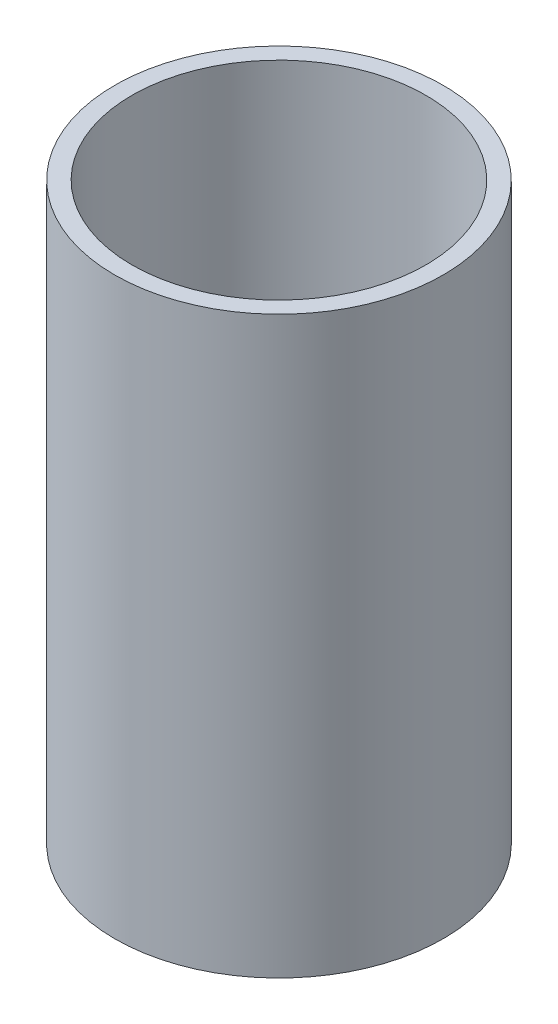
from build123d import *

# Parameters (mm, degrees)
SKETCH13_R                                   = 57.15
SKETCH13_R_2                                 = 51.1302
RURA_GRUBO_CIENNA_STANDARDOWA_S40_PIPE_DEPTH = 200


with BuildPart() as part:
    # Sketch13 → Rura grubościenna; standardowa s40 PIPE 4 SCH 40(1) (new body)
    with BuildSketch(Plane(origin=(0, 0, 0), x_dir=(1, 0, 0), z_dir=(0, 1, 0))):
        Circle(SKETCH13_R)
        Circle(SKETCH13_R_2, mode=Mode.SUBTRACT)
    extrude(amount=RURA_GRUBO_CIENNA_STANDARDOWA_S40_PIPE_DEPTH)


solid = part.part
